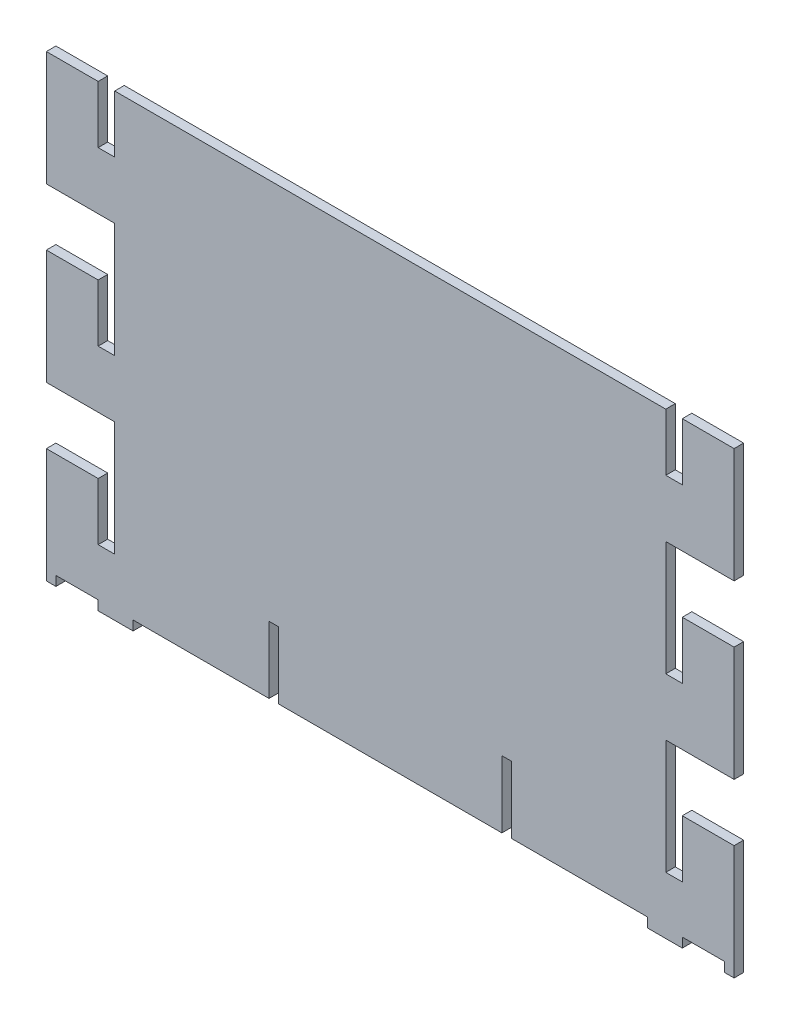
from build123d import *

# Parameters (mm, degrees)
SKETCH1_W           = 762
SKETCH1_H           = 12.7
BOSS_EXTRUDE1_DEPTH = 609.6
SKETCH2_W           = 12.7
SKETCH2_H           = 609.6
BOSS_EXTRUDE2_DEPTH = 76.2
SKETCH3_OUTSIDE_W   = 1136.21
SKETCH3_OUTSIDE_H   = 831.41
CUT_EXTRUDE1_DEPTH  = 12.7
SKETCH6_W           = 56.167651581
SKETCH6_H           = 12.7
SKETCH6_W_2         = 683.835303162
CUT_EXTRUDE2_DEPTH  = 12.7
SKETCH7_W           = 12.7
SKETCH7_H           = 88.9
CUT_EXTRUDE3_DEPTH  = 12.7
BOSS_EXTRUDE3_START = -101.6
SKETCH8_W           = 732.670606326
SKETCH8_H           = 12.7
BOSS_EXTRUDE3_DEPTH = 101.6
BOSS_EXTRUDE4_START = -12.7
SKETCH9_W           = 68.867651581
SKETCH9_H           = 12.7
BOSS_EXTRUDE4_DEPTH = 12.7


with BuildPart() as part:
    # Sketch1 → Boss-Extrude1 (new body)
    with BuildSketch(Plane(origin=(0, 0, 0), x_dir=(1, 0, 0), z_dir=(0, 1, 0))):
        with Locations((0, -653.561357684)):
            Rectangle(SKETCH1_W, SKETCH1_H)
    extrude(amount=BOSS_EXTRUDE1_DEPTH)

    # Sketch2 → Boss-Extrude2 (add)
    with BuildSketch(Plane(origin=(381, 0, 0), x_dir=(0, 0, -1), z_dir=(1, 0, 0))):
        with Locations((-653.561357684, 304.8)):
            Rectangle(SKETCH2_W, SKETCH2_H)
    boss_extrude2 = extrude(amount=BOSS_EXTRUDE2_DEPTH)

    # Mirror1: Boss-Extrude2 across plane
    add(boss_extrude2.mirror(Plane(origin=(0, 0, 0), x_dir=(0, 0, 1), z_dir=(1, 0, 0))))

    # Sketch3 outside → Cut-Extrude1 (cut)
    with BuildSketch(Plane.XY.offset(659.911357684)):
        with Locations((0, 304.8)):
            Rectangle(SKETCH3_OUTSIDE_W, SKETCH3_OUTSIDE_H)
        Polygon((366.335303163, 609.6), (-366.335303163, 609.6), (-366.335303163, 533.4), (-388.332348419, 533.4), (-388.332348419, 609.6), (-457.2, 609.6), (-457.2, 457.2), (-366.335303163, 457.2), (-366.335303163, 304.8), (-388.332348419, 304.8), (-388.332348419, 381), (-457.2, 381), (-457.2, 228.6), (-366.335303163, 228.6), (-366.335303163, 76.2), (-388.332348419, 76.2), (-388.332348419, 152.4), (-457.2, 152.4), (-457.2, 0), (457.2, 0), (457.2, 152.4), (388.332348419, 152.4), (388.332348419, 76.2), (366.335303163, 76.2), (366.335303163, 228.6), (457.2, 228.6), (457.2, 381), (388.332348419, 381), (388.332348419, 304.8), (366.335303163, 304.8), (366.335303163, 457.2), (457.2, 457.2), (457.2, 609.6), (388.332348419, 609.6), (388.332348419, 533.4), (366.335303163, 533.4), align=None, mode=Mode.SUBTRACT)
    extrude(amount=-CUT_EXTRUDE1_DEPTH, mode=Mode.SUBTRACT)

    # Sketch6 → Cut-Extrude2 (cut)
    with BuildSketch(Plane(origin=(0, 609.6, 0), x_dir=(1, 0, 0), z_dir=(0, 1, 0))):
        with Locations((-416.41617421, -653.561357684)):
            Rectangle(SKETCH6_W, SKETCH6_H)
        with Locations((0, -653.561357684)):
            Rectangle(SKETCH6_W_2, SKETCH6_H)
        with Locations((416.41617421, -653.561357684)):
            Rectangle(SKETCH6_W, SKETCH6_H)
    cut_extrude2 = extrude(amount=-CUT_EXTRUDE2_DEPTH, mode=Mode.SUBTRACT)

    # Sketch7 → Cut-Extrude3 (cut)
    with BuildSketch(Plane.XY.offset(659.911357684)):
        with Locations((154.820606325, 552.45)):
            Rectangle(SKETCH7_W, SKETCH7_H)
        with Locations((-154.820606325, 552.45)):
            Rectangle(SKETCH7_W, SKETCH7_H)
    cut_extrude3 = extrude(amount=-CUT_EXTRUDE3_DEPTH, mode=Mode.SUBTRACT)

    # Mirror2: Cut-Extrude2, Cut-Extrude3 across plane
    add(cut_extrude2.mirror(Plane(origin=(0, 304.8, 0), x_dir=(0, 0, 1), z_dir=(0, -1, 0))), mode=Mode.SUBTRACT)
    add(cut_extrude3.mirror(Plane(origin=(0, 304.8, 0), x_dir=(0, 0, 1), z_dir=(0, -1, 0))), mode=Mode.SUBTRACT)

    # Sketch8 → Boss-Extrude3 (add)
    with BuildSketch(Plane(origin=(0, 609.6, 0), x_dir=(1, 0, 0), z_dir=(0, 1, 0)).offset(BOSS_EXTRUDE3_START)):
        with Locations((0, -653.561357684)):
            Rectangle(SKETCH8_W, SKETCH8_H)
    extrude(amount=BOSS_EXTRUDE3_DEPTH)

    # Sketch9 → Boss-Extrude4 (add)
    with BuildSketch(Plane(origin=(0, 609.6, 0), x_dir=(1, 0, 0), z_dir=(0, 1, 0)).offset(BOSS_EXTRUDE4_START)):
        with Locations((422.76617421, -653.561357684)):
            Rectangle(SKETCH9_W, SKETCH9_H)
        with Locations((-422.76617421, -653.561357684)):
            Rectangle(SKETCH9_W, SKETCH9_H)
    extrude(amount=BOSS_EXTRUDE4_DEPTH)


solid = part.part
